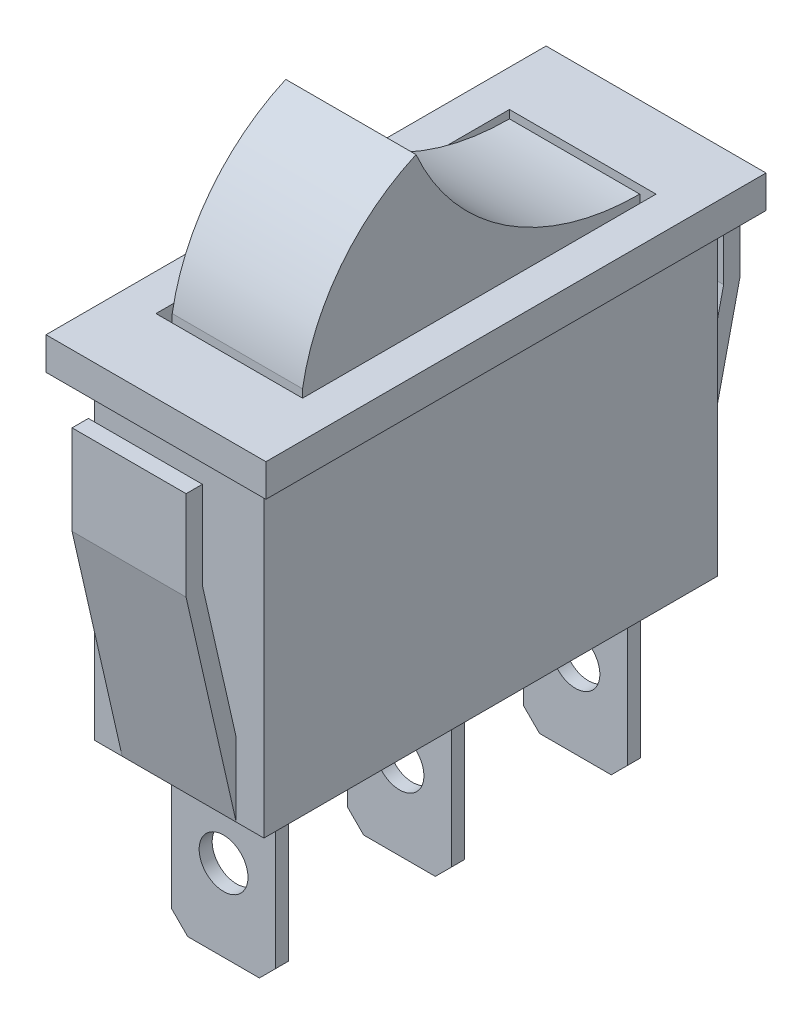
from build123d import *

# Parameters (mm, degrees)
RESSALTO_EXTRUS_O2_DEPTH = 6.75
ESBO_O3_W                = 20.7
ESBO_O3_H                = 8.969000478
CORTE_EXTRUS_O1_DEPTH    = 2.75
ESBO_O4_W                = 20.7
ESBO_O4_H                = 8.969000478
CORTE_EXTRUS_O2_DEPTH    = 2.75
ESBO_O5_W                = 34
ESBO_O5_H                = 19.5
CORTE_EXTRUS_O3_DEPTH    = 1.55
ESBO_O6_W                = 34
ESBO_O6_H                = 19.5
CORTE_EXTRUS_O4_DEPTH    = 1.55
ESBO_O8_W                = 3.076935564
ESBO_O8_H                = 19
ESBO_O8_W_2              = 3.076935565
CORTE_EXTRUS_O5_DEPTH    = 1.7
ESBO_O9_W                = 3.076935565
ESBO_O9_H                = 19
ESBO_O9_W_2              = 3.076935564
CORTE_EXTRUS_O6_DEPTH    = 1.7
ESBO_O10_W               = 9
ESBO_O10_H               = 21.7
ESBO_O10_W_2             = 8
ESBO_O10_H_2             = 20.7
CORTE_EXTRUS_O7_DEPTH    = 1
ESBO_O11_W               = 6.4
ESBO_O11_H               = 0.8
RESSALTO_EXTRUS_O3_DEPTH = 10.3
ESBO_O12_R               = 1.5
CORTE_EXTRUS_O8_DEPTH    = 43.061413316
CHANFRO1_SIZE            = 1


with BuildPart() as part:
    # Esboço1 → Ressalto-extrusão2 (new, symmetric)
    with BuildSketch(Plane(origin=(0, 0, 0), x_dir=(0, 0, -1), z_dir=(1, 0, 0))):
        with BuildLine():
            Line((0, 0), (27.846128871, 0))
            Line((27.846128871, 0), (30.923064436, 13.5))
            Line((30.923064436, 13.5), (30.923064436, 19))
            Line((30.923064436, 19), (29.923064436, 19))
            Line((29.923064436, 19), (29.923064436, 13.612517806))
            Line((29.923064436, 13.612517806), (27.846128871, 4.5))
            Line((27.846128871, 4.5), (27.846128871, 19.5))
            Line((27.846128871, 19.5), (29.273064436, 19.5))
            Line((29.273064436, 19.5), (29.273064436, 21.5))
            Line((29.273064436, 21.5), (24.273064436, 21.5))
            ThreePointArc((24.273064436, 21.5), (16.071387559, 23.940840139), (10.5389083, 30.469000478))
            ThreePointArc((10.5389083, 30.469000478), (5.927855619, 26.860671745), (3.573064436, 21.5))
            Line((3.573064436, 21.5), (-1.426935564, 21.5))
            Line((-1.426935564, 21.5), (-1.426935564, 19.5))
            Line((-1.426935564, 19.5), (0, 19.5))
            Line((0, 19.5), (0, 4.5))
            Line((0, 4.5), (-2.076935564, 13.612517806))
            Line((-2.076935564, 13.612517806), (-2.076935564, 19))
            Line((-2.076935564, 19), (-3.076935564, 19))
            Line((-3.076935564, 19), (-3.076935564, 13.5))
            Line((-3.076935564, 13.5), (0, 0))
        make_face()
    extrude(amount=RESSALTO_EXTRUS_O2_DEPTH, both=True)

    # Esboço3 → Corte-extrusão1 (cut)
    with BuildSketch(Plane(origin=(6.75, 0, 0), x_dir=(0, 0, -1), z_dir=(1, 0, 0))):
        with Locations((13.923064436, 25.984500239)):
            Rectangle(ESBO_O3_W, ESBO_O3_H)
    extrude(amount=-CORTE_EXTRUS_O1_DEPTH, mode=Mode.SUBTRACT)

    # Esboço4 → Corte-extrusão2 (cut)
    with BuildSketch(Plane.ZY.offset(6.75)):
        with Locations((-13.923064436, 25.984500239)):
            Rectangle(ESBO_O4_W, ESBO_O4_H)
    extrude(amount=-CORTE_EXTRUS_O2_DEPTH, mode=Mode.SUBTRACT)

    # Esboço5 → Corte-extrusão3 (cut)
    with BuildSketch(Plane.ZY.offset(6.75)):
        with Locations((-13.923064436, 9.75)):
            Rectangle(ESBO_O5_W, ESBO_O5_H)
    extrude(amount=-CORTE_EXTRUS_O3_DEPTH, mode=Mode.SUBTRACT)

    # Esboço6 → Corte-extrusão4 (cut)
    with BuildSketch(Plane(origin=(6.75, 0, 0), x_dir=(0, 0, -1), z_dir=(1, 0, 0))):
        with Locations((13.923064436, 9.75)):
            Rectangle(ESBO_O6_W, ESBO_O6_H)
    extrude(amount=-CORTE_EXTRUS_O4_DEPTH, mode=Mode.SUBTRACT)

    # Esboço8 → Corte-extrusão5 (cut)
    with BuildSketch(Plane(origin=(5.2, 0, 0), x_dir=(0, 0, -1), z_dir=(1, 0, 0))):
        with Locations((-1.538467782, 9.5)):
            Rectangle(ESBO_O8_W, ESBO_O8_H)
        with Locations((29.384596654, 9.5)):
            Rectangle(ESBO_O8_W_2, ESBO_O8_H)
    extrude(amount=-CORTE_EXTRUS_O5_DEPTH, mode=Mode.SUBTRACT)

    # Esboço9 → Corte-extrusão6 (cut)
    with BuildSketch(Plane.ZY.offset(5.2)):
        with Locations((-29.384596654, 9.5)):
            Rectangle(ESBO_O9_W, ESBO_O9_H)
        with Locations((1.538467782, 9.5)):
            Rectangle(ESBO_O9_W_2, ESBO_O9_H)
    extrude(amount=-CORTE_EXTRUS_O6_DEPTH, mode=Mode.SUBTRACT)

    # Esboço10 → Corte-extrusão7 (cut)
    with BuildSketch(Plane(origin=(0, 21.5, 0), x_dir=(1, 0, 0), z_dir=(0, 1, 0))):
        with Locations((0, 13.923064436)):
            Rectangle(ESBO_O10_W, ESBO_O10_H)
        with Locations((0, 13.923064436)):
            Rectangle(ESBO_O10_W_2, ESBO_O10_H_2, mode=Mode.SUBTRACT)
    extrude(amount=-CORTE_EXTRUS_O7_DEPTH, mode=Mode.SUBTRACT)

    # Esboço11 → Ressalto-extrusão3 (add)
    with BuildSketch(Plane.XZ):
        with Locations((0, -3.123064436)):
            Rectangle(ESBO_O11_W, ESBO_O11_H)
        with Locations((0, -13.923064436)):
            Rectangle(ESBO_O11_W, ESBO_O11_H)
        with Locations((0, -24.723064436)):
            Rectangle(ESBO_O11_W, ESBO_O11_H)
    extrude(amount=RESSALTO_EXTRUS_O3_DEPTH)

    # Esboço12 → Corte-extrusão8 (cut, through all)
    with BuildSketch(Plane(origin=(0, 0, -25.123064436), x_dir=(-1, 0, 0), z_dir=(0, 0, -1))):
        with Locations((0, -5.3)):
            Circle(ESBO_O12_R)
    extrude(amount=-CORTE_EXTRUS_O8_DEPTH, mode=Mode.SUBTRACT)

    # Chanfro1
    chanfro1_edges = [part.edges().sort_by_distance(p)[0] for p in [
        (-3.2, -10.3, -3.123064436),
        (3.2, -10.3, -3.123064436),
        (-3.2, -10.3, -13.923064436),
        (3.2, -10.3, -13.923064436),
        (-3.2, -10.3, -24.723064436),
        (3.2, -10.3, -24.723064436),
    ]]
    chamfer(chanfro1_edges, length=CHANFRO1_SIZE)


solid = part.part
